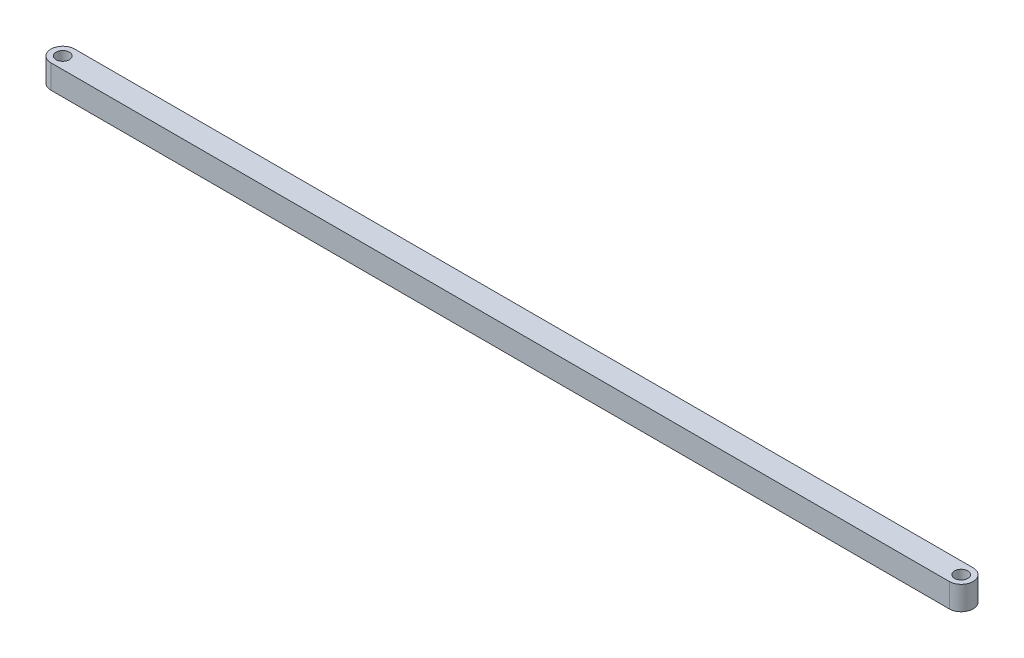
from build123d import *

# Parameters (mm, degrees)
SKETCH1_R           = 2.5
BOSS_EXTRUDE1_DEPTH = 9


with BuildPart() as part:
    # Sketch1 → Boss-Extrude1 (new body)
    with BuildSketch(Plane(origin=(0, 4.5, 0), x_dir=(1, 0, 0), z_dir=(0, 1, 0))):
        with BuildLine():
            Line((170, 4.5), (-170, 4.5))
            ThreePointArc((-170, 4.5), (-174.5, 0), (-170, -4.5))
            Line((-170, -4.5), (170, -4.5))
            ThreePointArc((170, -4.5), (174.5, 0), (170, 4.5))
        make_face()
        with Locations(Location((170, 0, 0), (0, 0, 90))):
            Circle(SKETCH1_R, mode=Mode.SUBTRACT)
        with Locations(Location((-170, 0, 0), (0, 0, 90))):
            Circle(SKETCH1_R, mode=Mode.SUBTRACT)
    extrude(amount=-BOSS_EXTRUDE1_DEPTH)


solid = part.part
